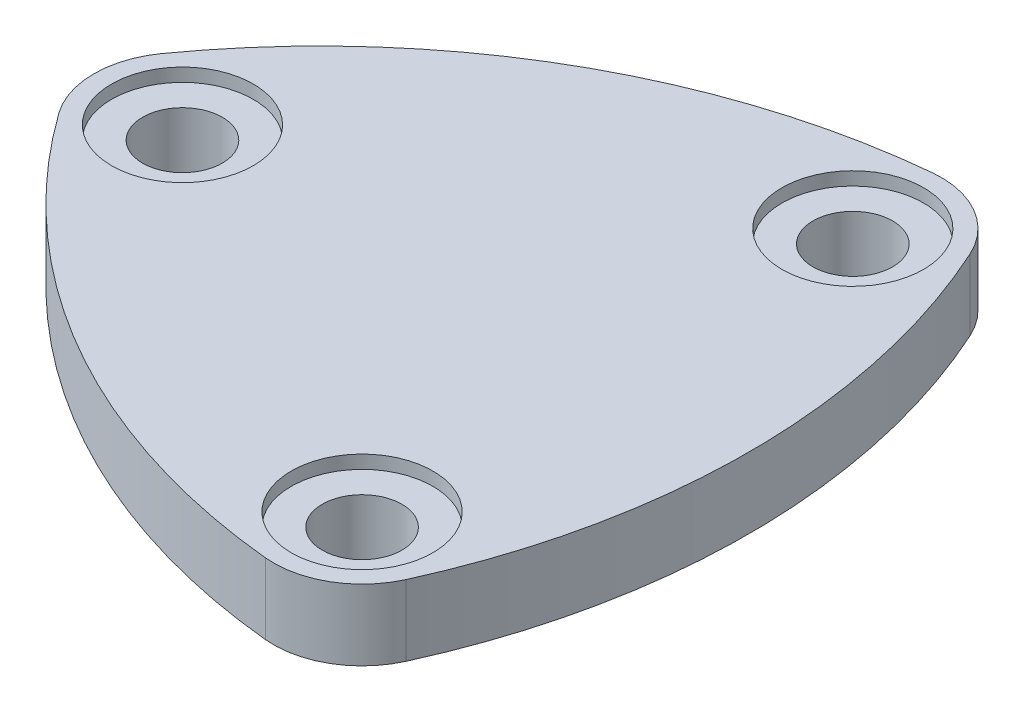
from build123d import *

# Parameters (mm, degrees)
EXTRUDE_1_DEPTH     = 8
SKETCH_1_3_R        = 10
SKETCH_1_3_R_2      = 4.5
EXTRUDE_2_DEPTH     = 8
SKETCH_2_R          = 8
CUT_EXTRUDE_1_DEPTH = 1.5


with BuildPart() as part:
    # 草圖1 → 填料-伸長1 (new body)
    with BuildSketch(Plane(origin=(0, 0, 0), x_dir=(1, 0, 0), z_dir=(0, 1, 0))):
        with BuildLine():
            ThreePointArc((-40.134328358, 5.816588533), (-28.945763891, 9.522165814), (-22, 0))
            ThreePointArc((-22, 0), (-28.945763891, -9.522165814), (-40.134328358, -5.816588533))
            ThreePointArc((-40.134328358, -5.816588533), (-16, -27.712812921), (15.029850746, -37.665642188))
            ThreePointArc((15.029850746, -37.665642188), (9.28068056, -20.306683955), (26, -27.712812921))
            ThreePointArc((26, -27.712812921), (25.773555549, -29.828849769), (25.104477612, -31.849053656))
            ThreePointArc((25.104477612, -31.849053656), (32, 0), (25.104477612, 31.849053656))
            ThreePointArc((25.104477612, 31.849053656), (25.773555549, 29.828849769), (26, 27.712812921))
            ThreePointArc((26, 27.712812921), (9.28068056, 20.306683955), (15.029850746, 37.665642188))
            ThreePointArc((15.029850746, 37.665642188), (-16, 27.712812921), (-40.134328358, 5.816588533))
        make_face()
    extrude(amount=EXTRUDE_1_DEPTH)

    # 草圖1<3> → 填料-伸長2 (add)
    # profile 1 of 3: a face of its own
    with BuildSketch(Plane(origin=(0, 0, 0), x_dir=(1, 0, 0), z_dir=(0, 1, 0))):
        with Locations((-32, 0)):
            Circle(SKETCH_1_3_R)
        with Locations((-32, 0)):
            Circle(SKETCH_1_3_R_2, mode=Mode.SUBTRACT)
    # profile 2 of 3: a face of its own
    with BuildSketch(Plane(origin=(0, 0, 0), x_dir=(1, 0, 0), z_dir=(0, 1, 0))):
        with Locations((16, 27.712812921)):
            Circle(SKETCH_1_3_R)
        with Locations((16, 27.712812921)):
            Circle(SKETCH_1_3_R_2, mode=Mode.SUBTRACT)
    # profile 3 of 3: a face of its own
    with BuildSketch(Plane(origin=(0, 0, 0), x_dir=(1, 0, 0), z_dir=(0, 1, 0))):
        with Locations((16, -27.712812921)):
            Circle(SKETCH_1_3_R)
        with Locations((16, -27.712812921)):
            Circle(SKETCH_1_3_R_2, mode=Mode.SUBTRACT)
    extrude(amount=EXTRUDE_2_DEPTH)

    # 草圖2 → 除料-伸長1 (cut)
    with BuildSketch(Plane(origin=(0, 8, 0), x_dir=(1, 0, 0), z_dir=(0, 1, 0))):
        with Locations((-32, 0)):
            Circle(SKETCH_2_R)
        with Locations((16, 27.712812921)):
            Circle(SKETCH_2_R)
        with Locations((16, -27.712812921)):
            Circle(SKETCH_2_R)
    extrude(amount=-CUT_EXTRUDE_1_DEPTH, mode=Mode.SUBTRACT)


solid = part.part
